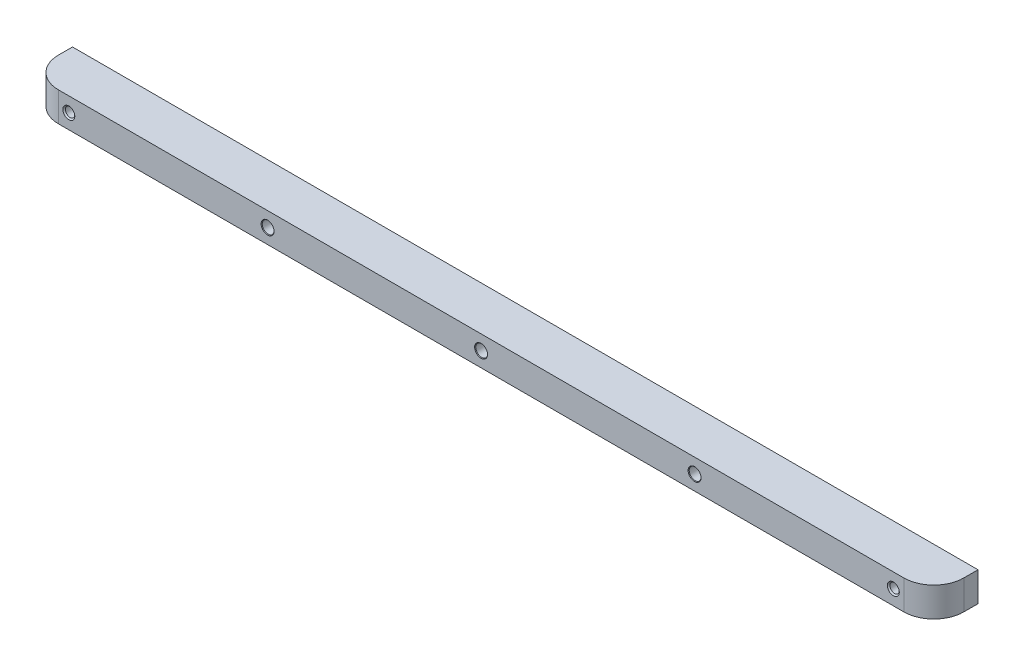
from build123d import *

# Parameters (mm, degrees)
SKETCH1_W                                    = 390.525
SKETCH1_H                                    = 19.05
EXTRUDE1_DEPTH                               = 6.35
FILLET1_R                                    = 12.954
COUNTERDRILLED_10_32_AT_2_COUNT              = 2
COUNTERDRILLED_10_32_AT_2_PITCH              = 355.6
CBORE_FOR_10_SOCKET_HEAD_CAP_SCREW1_AT_COUNT = 2
CBORE_FOR_10_SOCKET_HEAD_CAP_SCREW1_AT_PITCH = 92.075
CBORE_FOR_10_SOCKET_HEAD_CAP_SCREW1_2_COUNT  = 2
CBORE_FOR_10_SOCKET_HEAD_CAP_SCREW1_2_PITCH  = 184.15
CHAMFER1_SIZE                                = 0.254
CHAMFER2_SIZE                                = 0.5588


with BuildPart() as part:
    # Sketch1 → Extrude1 (new, symmetric)
    with BuildSketch(Plane(origin=(0, 0, 0), x_dir=(1, 0, 0), z_dir=(0, 1, 0))):
        with Locations((0, 9.525)):
            Rectangle(SKETCH1_W, SKETCH1_H)
    extrude(amount=EXTRUDE1_DEPTH, both=True)

    # Fillet1
    fillet1_edges = [part.edges().sort_by_distance(p)[0] for p in [
        (195.2625, 0, 0),
        (-195.2625, 0, 0),
    ]]
    fillet(fillet1_edges, radius=FILLET1_R)

    # Sketch3 → counterdrilled 10-32 (revolve, cut)
    with BuildSketch(Plane(origin=(177.8, 0, -19.05), x_dir=(0, 1, 0), z_dir=(1, 0, 0))):
        Polygon((0, 0), (0, 19.05), (2.0193, 19.05), (2.0193, 9.845499054), (2.5527, 9.525), (2.5527, 0), align=None)
    counterdrilled_10_32 = revolve(axis=Axis((177.8, 0, -25.180023899), (0, 0, 1)), mode=Mode.SUBTRACT)

    # counterdrilled 10-32 at 2: counterdrilled 10-32 ×2
    with Locations(*[(-i * COUNTERDRILLED_10_32_AT_2_PITCH, 0, 0) for i in range(1, COUNTERDRILLED_10_32_AT_2_COUNT)]):
        add(counterdrilled_10_32, mode=Mode.SUBTRACT)

    # Sketch5 → CBORE for #10 Socket Head Cap Screw1 (revolve, cut)
    with BuildSketch(Plane(origin=(92.075, 0, -19.05), x_dir=(0, 1, 0), z_dir=(1, 0, 0))):
        Polygon((0, 0), (0, 19.05), (2.794, 19.05), (2.5527, 18.8087), (2.5527, 5.334), (4.3688, 5.334), (4.3688, 0.254), (4.6228, 0), align=None)
    cbore_for_10_socket_head_cap_screw1 = revolve(axis=Axis((92.075, 0, -25.4), (0, 0, 1)), mode=Mode.SUBTRACT)

    # CBORE for #10 Socket Head Cap Screw1 at: CBORE for #10 Socket Head Cap Screw1 ×2
    with Locations(*[(-i * CBORE_FOR_10_SOCKET_HEAD_CAP_SCREW1_AT_PITCH, 0, 0) for i in range(1, CBORE_FOR_10_SOCKET_HEAD_CAP_SCREW1_AT_COUNT)]):
        add(cbore_for_10_socket_head_cap_screw1, mode=Mode.SUBTRACT)

    # CBORE for _10 Socket Head Cap Screw1 2: CBORE for #10 Socket Head Cap Screw1 ×2
    with Locations(*[(-i * CBORE_FOR_10_SOCKET_HEAD_CAP_SCREW1_2_PITCH, 0, 0) for i in range(1, CBORE_FOR_10_SOCKET_HEAD_CAP_SCREW1_2_COUNT)]):
        add(cbore_for_10_socket_head_cap_screw1, mode=Mode.SUBTRACT)

    # Chamfer1
    chamfer1_edges = [part.edges().sort_by_distance(p)[0] for p in [
        (-177.8, -2.5527, -19.05),
        (177.8, -2.5527, -19.05),
    ]]
    chamfer(chamfer1_edges, length=CHAMFER1_SIZE)

    # Chamfer2
    chamfer2_edges = [part.edges().sort_by_distance(p)[0] for p in [
        (-177.8, -2.0193, 0),
        (177.8, -2.0193, 0),
    ]]
    chamfer(chamfer2_edges, length=CHAMFER2_SIZE)


solid = part.part
